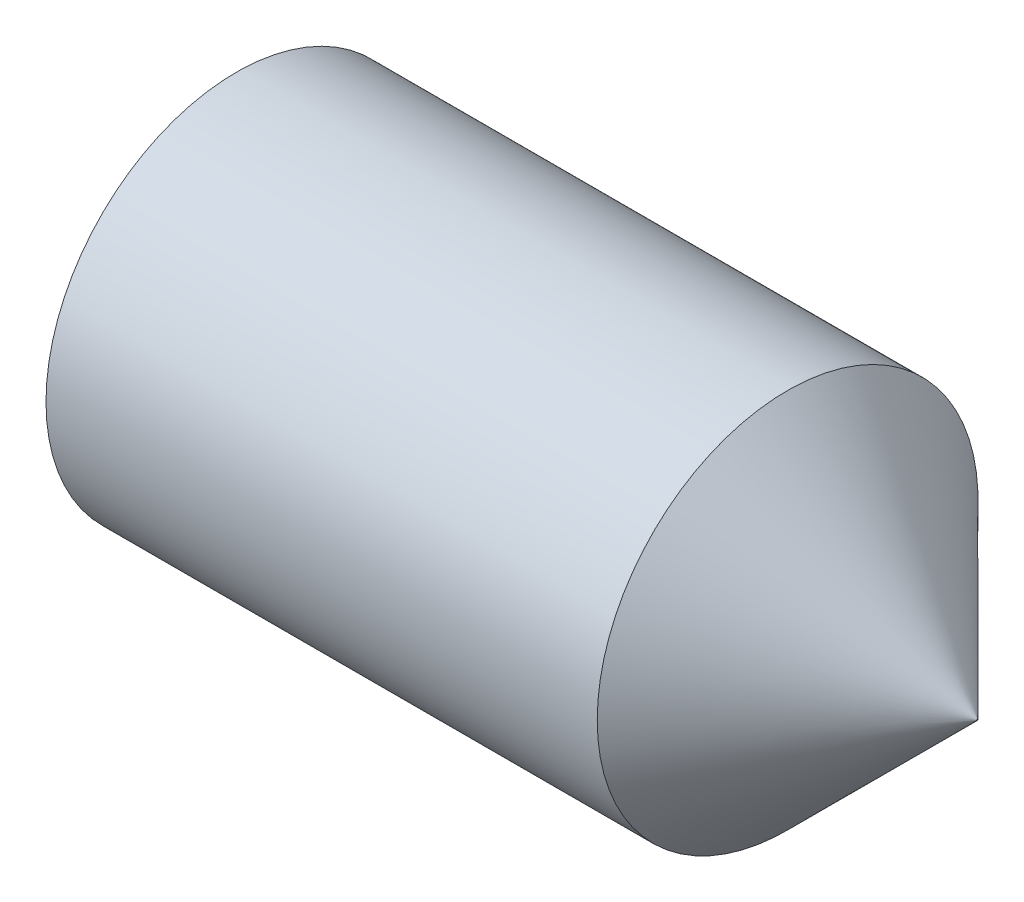
from build123d import *

# Parameters (mm, degrees)
HEX_2_DEPTH = 2.1


with BuildPart() as part:
    # BodySke → BaseBody (revolve)
    with BuildSketch(Plane.XY, mode=Mode.PRIVATE) as basebody_sk:
        Polygon((0, 0), (0, 1.2195), (0.161946751, 1.5), (4.505, 1.5), (6, 0.005), (6, 0), align=None)
    revolve(basebody_sk.sketch.rotate(Axis((-12.7, 0, 0), (1, 0, 0)), 90), axis=Axis((-12.7, 0, 0), (1, 0, 0)))

    # Sketch2 → Hex 2 (cut)
    with BuildSketch(Plane.ZY):
        Polygon((0.433012702, 0.75), (-0.433012702, 0.75), (-0.866025404, 0), (-0.433012702, -0.75), (0.433012702, -0.75), (0.866025404, 0), align=None)
    extrude(amount=-HEX_2_DEPTH, mode=Mode.SUBTRACT)


solid = part.part
